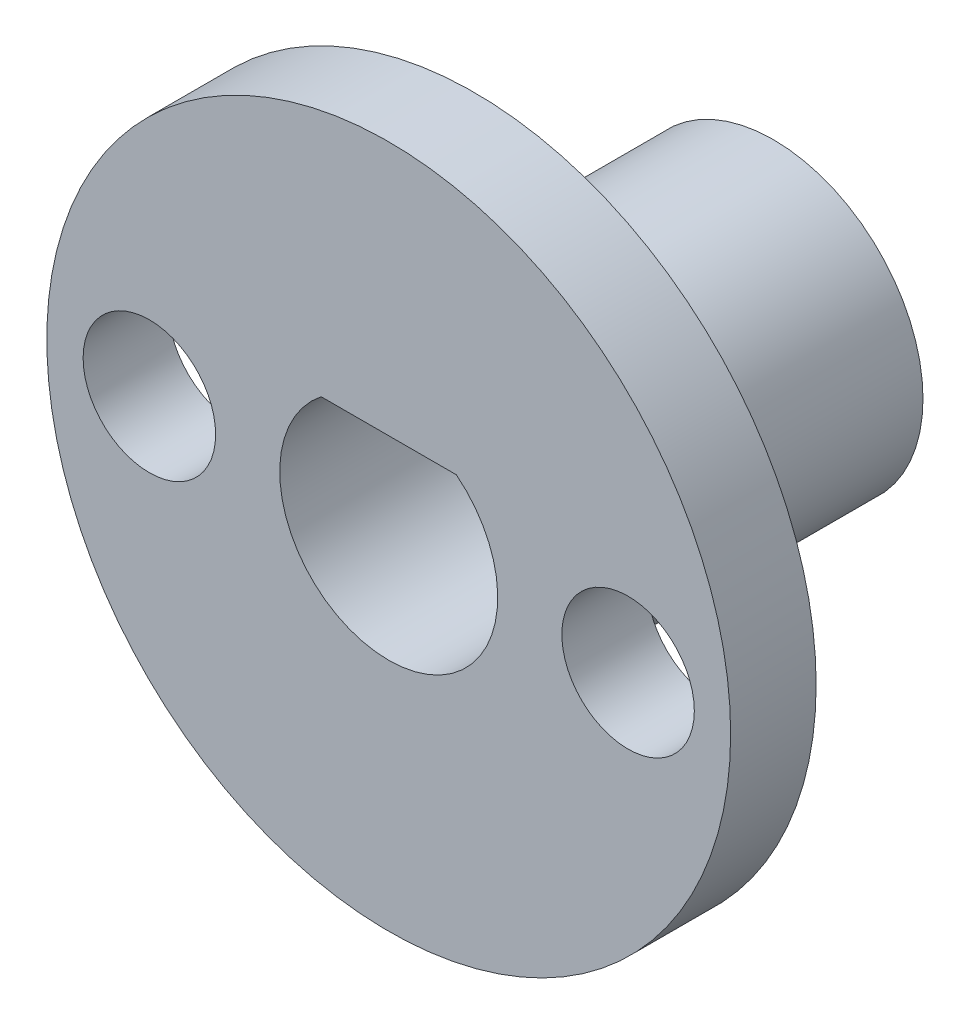
from build123d import *

# Parameters (mm, degrees)
EXTRUDE_1_DEPTH          = 6
EXTRUDE_1_DEPTH_BACK     = 3
SKETCH_1_R               = 3.5
CUT_EXTRUDE_1_DEPTH      = 11.271319292
CUT_EXTRUDE_1_DEPTH_BACK = 11.271319292
SKETCH_3_R               = 8
EXTRUDE_2_DEPTH          = 2
CUT_EXTRUDE_2_DEPTH      = 15.480802494
SKETCH_5_R               = 1.55
CUT_EXTRUDE_3_DEPTH      = 2.5


with BuildPart() as part:
    # 草图1 → 凸台-拉伸1 (new, two sides: drawn at the far end of the back side and taken through both)
    with BuildSketch(Plane.XY.offset(-EXTRUDE_1_DEPTH_BACK)):
        Circle(SKETCH_1_R)
    extrude(amount=EXTRUDE_1_DEPTH + EXTRUDE_1_DEPTH_BACK)

    # 草图2 → 切除-拉伸1 (cut, two sides: drawn at the far end of the back side and taken through both)
    with BuildSketch(Plane(origin=(0, 0, -3), x_dir=(-1, 0, 0), z_dir=(0, 0, -1)).offset(-CUT_EXTRUDE_1_DEPTH_BACK)):
        with BuildLine():
            Line((1.581929202, 2), (-1.581929202, 2))
            ThreePointArc((-1.581929202, 2), (0, -2.55), (1.581929202, 2))
        make_face()
    extrude(amount=CUT_EXTRUDE_1_DEPTH + CUT_EXTRUDE_1_DEPTH_BACK, mode=Mode.SUBTRACT)

    # 草图3 → 凸台-拉伸2 (add)
    with BuildSketch(Plane.XY.offset(6)):
        with Locations((0, -0.043235721)):
            Circle(SKETCH_3_R)
    extrude(amount=-EXTRUDE_2_DEPTH)

    # 草图4 → 切除-拉伸2 (cut, through all)
    with BuildSketch(Plane.XY.offset(6)):
        with BuildLine():
            Line((-1.581929202, 2), (1.581929202, 2))
            ThreePointArc((1.581929202, 2), (0, -2.55), (-1.581929202, 2))
        make_face()
    extrude(amount=-CUT_EXTRUDE_2_DEPTH, mode=Mode.SUBTRACT)

    # 草图5 → 切除-拉伸3 (cut)
    with BuildSketch(Plane.XY.offset(6)):
        with Locations((5.6, 0)):
            Circle(SKETCH_5_R)
        with Locations((-5.6, 0)):
            Circle(SKETCH_5_R)
    extrude(amount=-CUT_EXTRUDE_3_DEPTH, mode=Mode.SUBTRACT)


solid = part.part
